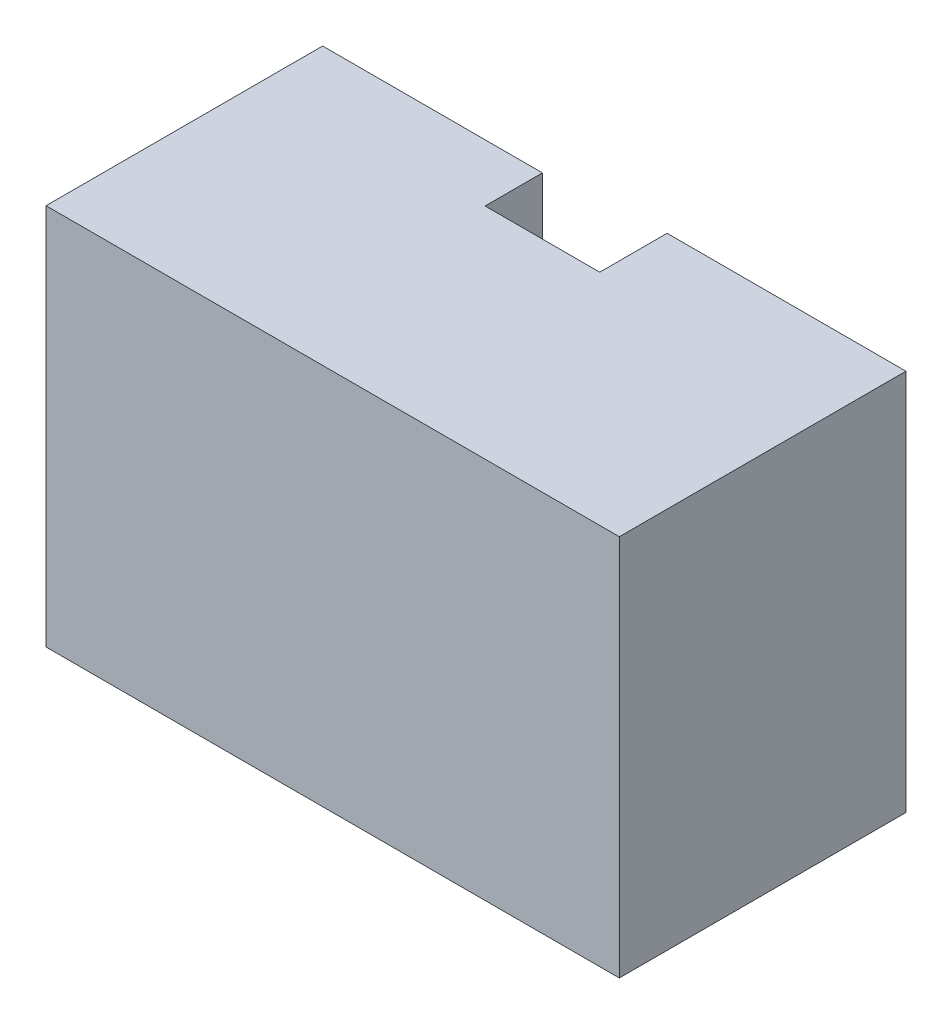
from build123d import *

# Parameters (mm, degrees)
EXTRUDE_1_DEPTH = 200


with BuildPart() as part:
    # Эскиз1 → Бобышка-Вытянуть1 (new, symmetric)
    with BuildSketch(Plane(origin=(0, 0, 0), x_dir=(1, 0, 0), z_dir=(0, 1, 0))):
        Polygon((90, 289.5), (230, 289.5), (230, 229.5), (350, 229.5), (350, 300), (600, 300), (600, 0), (100, 0), (0, 0), (0, 289.5), align=None)
    extrude(amount=EXTRUDE_1_DEPTH, both=True)


solid = part.part
